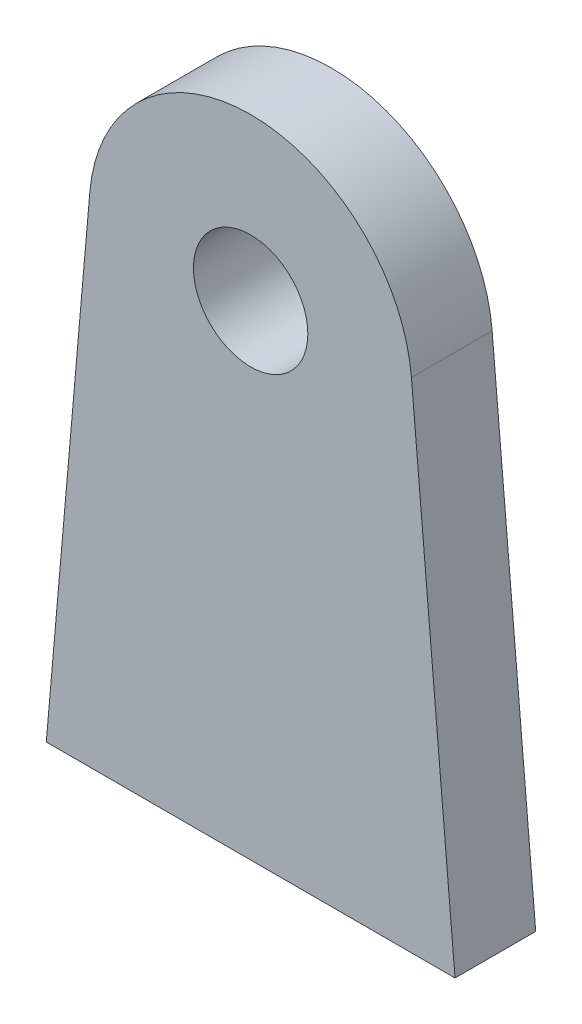
from build123d import *

# Parameters (mm, degrees)
BOSS_EXTRUDE1_DEPTH      = 3.175
M4_CLEARANCE_HOLE1_D     = 4.5
M4_CLEARANCE_HOLE1_DEPTH = 16.002
M4_CLEARANCE_HOLE1_TIP   = 1.351936393


with BuildPart() as part:
    # Sketch1 → Boss-Extrude1 (new body)
    with BuildSketch(Plane.XY):
        with BuildLine():
            Line((0, 0), (16.081830017, 0))
            Line((16.081830017, 0), (14.366751341, 19.603438966))
            ThreePointArc((14.366751341, 19.603438966), (8.040915009, 25.4), (1.715078676, 19.603438966))
            Line((1.715078676, 19.603438966), (0, 0))
        make_face()
    extrude(amount=BOSS_EXTRUDE1_DEPTH)

    # M4 Clearance Hole1
    with Locations(Plane.XY.offset(3.175)):
        with Locations((8.040915009, 19.05)):
            Hole(M4_CLEARANCE_HOLE1_D / 2, depth=M4_CLEARANCE_HOLE1_DEPTH)
            with Locations((0, 0, -(M4_CLEARANCE_HOLE1_DEPTH + M4_CLEARANCE_HOLE1_TIP / 2))):  # 118° drill point
                Cone(0, M4_CLEARANCE_HOLE1_D / 2, M4_CLEARANCE_HOLE1_TIP, mode=Mode.SUBTRACT)


solid = part.part
